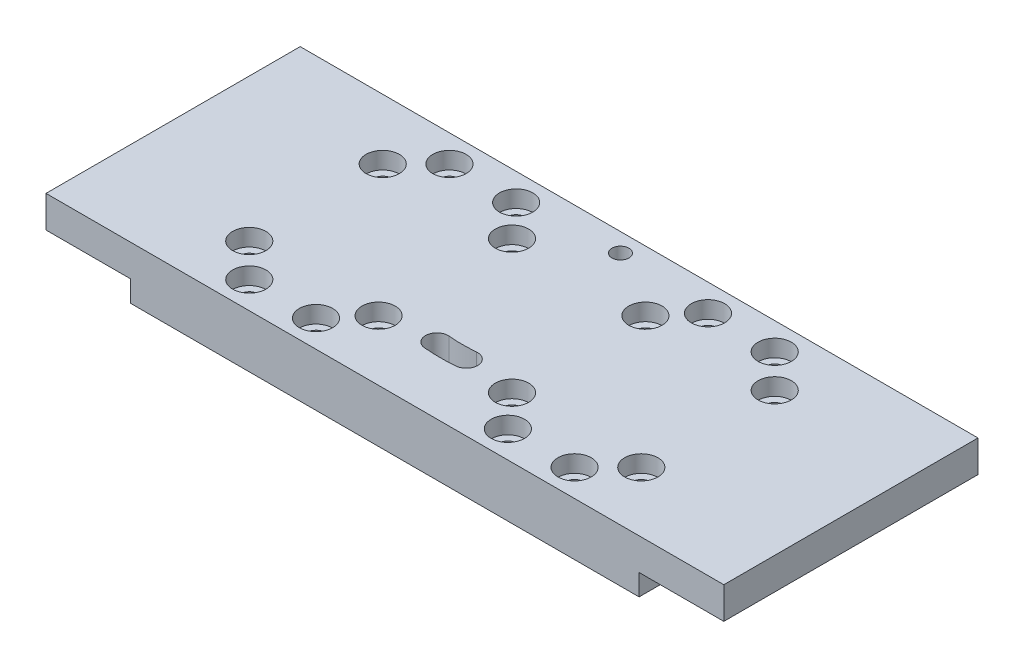
from build123d import *

# Parameters (mm, degrees)
SKETCH1_W                      = 203.2
SKETCH1_H                      = 76.2
BOSS_EXTRUDE1_DEPTH            = 15.875
F_1_4_20_TAPPED_HOLE1_D        = 5.1054
CUT_EXTRUDE1_DEPTH             = 110.663966849
CUT_EXTRUDE2_DEPTH             = 6.35
CBORE_FOR_M5_SHCS2_D           = 5.5
CBORE_FOR_M5_SHCS2_CBORE_D     = 10
CBORE_FOR_M5_SHCS2_CBORE_DEPTH = 5.1
SKETCH12_W                     = 25.4
SKETCH12_H                     = 76.2
CUT_EXTRUDE3_DEPTH             = 6.35


with BuildPart() as part:
    # Sketch1 → Boss-Extrude1 (new body)
    with BuildSketch(Plane(origin=(0, 0, 0), x_dir=(1, 0, 0), z_dir=(0, 1, 0))):
        Rectangle(SKETCH1_W, SKETCH1_H)
    extrude(amount=BOSS_EXTRUDE1_DEPTH)

    # 1/4-20 Tapped Hole1 (through all)
    with Locations(Plane(origin=(0, 15.875, 0), x_dir=(1, 0, 0), z_dir=(0, 1, 0))):
        with Locations((0, 32.5)):
            Hole(F_1_4_20_TAPPED_HOLE1_D / 2)

    # Sketch4 → Cut-Extrude1 (cut, through all)
    with BuildSketch(Plane(origin=(0, 15.875, 0), x_dir=(1, 0, 0), z_dir=(0, 1, 0))):
        with BuildLine():
            ThreePointArc((-4.721526183, -21.467291215), (0, -21.6734375), (4.721526183, -21.467291215))
            ThreePointArc((4.721526183, -21.467291215), (7.788112283, -17.812676212), (4.133497281, -14.746090111))
            ThreePointArc((4.133497281, -14.746090111), (0, -14.9265625), (-4.133497281, -14.746090111))
            ThreePointArc((-4.133497281, -14.746090111), (-7.788112283, -17.812676212), (-4.721526183, -21.467291215))
        make_face()
    extrude(amount=-CUT_EXTRUDE1_DEPTH, mode=Mode.SUBTRACT)

    # Sketch6 → Cut-Extrude2 (cut)
    with BuildSketch(Plane.XZ):
        with BuildLine():
            ThreePointArc((11.149411903, 23.551878775), (0, 24.65), (-11.149411903, 23.551878775))
            ThreePointArc((-11.149411903, 23.551878775), (-16.138574889, 16.0850687), (-8.671764814, 11.095905714))
            ThreePointArc((-8.671764814, 11.095905714), (0, 11.95), (8.671764814, 11.095905714))
            ThreePointArc((8.671764814, 11.095905714), (16.138574889, 16.0850687), (11.149411903, 23.551878775))
        make_face()
    extrude(amount=-CUT_EXTRUDE2_DEPTH, mode=Mode.SUBTRACT)

    # CBORE for M5 SHCS2 (through all)
    with Locations(Plane(origin=(0, 15.875, 0), x_dir=(1, 0, 0), z_dir=(0, 1, 0))):
        with Locations((58.76, -20), (48.755, -30), (28.755, -30), (20, -20), (20, 20), (28.755, 30), (48.755, 30), (58.76, 20), (-28.755, 30), (-20, 20), (-48.755, 30), (-58.76, 20), (-58.76, -20), (-48.755, -30), (-28.755, -30), (-20, -20)):
            CounterBoreHole(CBORE_FOR_M5_SHCS2_D / 2, CBORE_FOR_M5_SHCS2_CBORE_D / 2, CBORE_FOR_M5_SHCS2_CBORE_DEPTH)

    # Sketch12 → Cut-Extrude3 (cut)
    with BuildSketch(Plane.XZ):
        with Locations((88.9, 0)):
            Rectangle(SKETCH12_W, SKETCH12_H)
    cut_extrude3 = extrude(amount=-CUT_EXTRUDE3_DEPTH, mode=Mode.SUBTRACT)

    # Mirror1: Cut-Extrude3 across plane
    add(cut_extrude3.mirror(Plane(origin=(0, 0, 0), x_dir=(0, 0, 1), z_dir=(1, 0, 0))), mode=Mode.SUBTRACT)


solid = part.part
